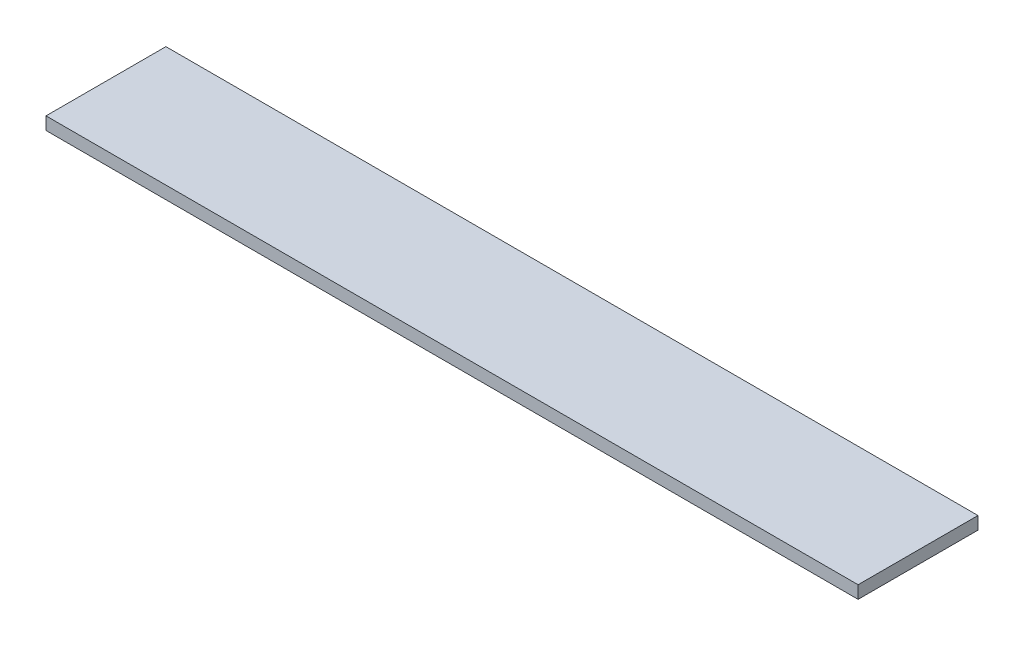
from build123d import *

# Parameters (mm, degrees)
SKETCH1_W           = 203.2
SKETCH1_H           = 30
BOSS_EXTRUDE1_DEPTH = 3.175


with BuildPart() as part:
    # Sketch1 → Boss-Extrude1 (new body)
    with BuildSketch(Plane(origin=(0, 0, 0), x_dir=(1, 0, 0), z_dir=(0, 1, 0))):
        with Locations((101.6, 15)):
            Rectangle(SKETCH1_W, SKETCH1_H)
    extrude(amount=BOSS_EXTRUDE1_DEPTH)


solid = part.part
